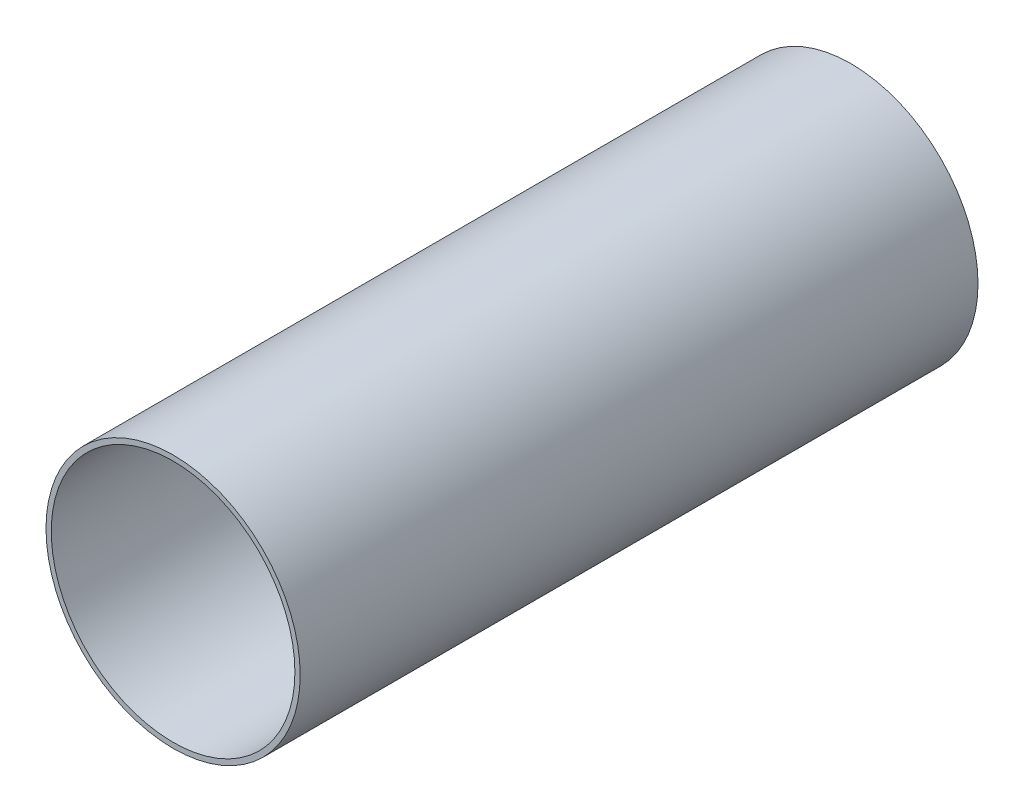
from build123d import *

# Parameters (mm, degrees)
SKETCH1_R           = 38.1
SKETCH1_R_2         = 36.5252
BOSS_EXTRUDE1_DEPTH = 203.2


with BuildPart() as part:
    # Sketch1 → Boss-Extrude1 (new body)
    with BuildSketch(Plane.XY):
        Circle(SKETCH1_R)
        Circle(SKETCH1_R_2, mode=Mode.SUBTRACT)
    extrude(amount=BOSS_EXTRUDE1_DEPTH)


solid = part.part
